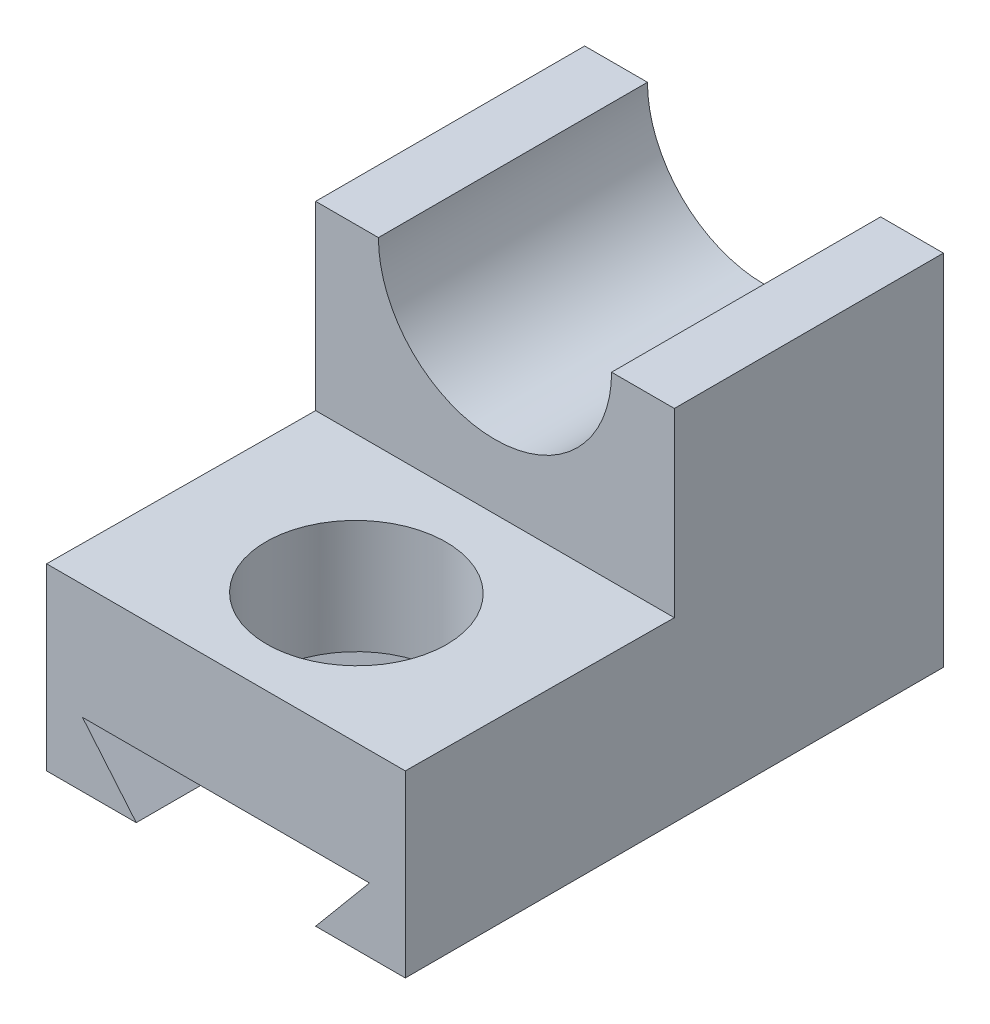
from build123d import *

# Parameters (mm, degrees)
EXTRUDE_1_DEPTH          = 508
CUT_EXTRUDE_1_DEPTH      = 1048.268828907
CUT_EXTRUDE_1_DEPTH_BACK = 1048.268828907
CUT_EXTRUDE_2_DEPTH      = 1048.268828907
CUT_EXTRUDE_2_DEPTH_BACK = 1048.268828907
CUT_EXTRUDE_3_DEPTH      = 1048.268828907
CUT_EXTRUDE_3_DEPTH_BACK = 1048.268828907
SKETCH_5_R               = 254


with BuildPart() as part:
    # 草图2 → 凸台-拉伸1 (new, symmetric)
    with BuildSketch(Plane(origin=(0, 0, 0), x_dir=(0, 0, -1), z_dir=(1, 0, 0))):
        Polygon((0, 508), (762, 508), (762, -508), (-762, -508), (-762, 0), (0, -5.276054191), align=None)
    extrude(amount=EXTRUDE_1_DEPTH, both=True)

    # 草图3 → 切除-拉伸1 (cut, two sides: drawn at the far end of the back side and taken through both)
    with BuildSketch(Plane.XY.offset(-CUT_EXTRUDE_1_DEPTH_BACK)):
        with BuildLine():
            Line((-330.2, 508), (330.2, 508))
            ThreePointArc((330.2, 508), (0, 177.8), (-330.2, 508))
        make_face()
    extrude(amount=CUT_EXTRUDE_1_DEPTH + CUT_EXTRUDE_1_DEPTH_BACK, mode=Mode.SUBTRACT)

    # 草图4 → 切除-拉伸2 (cut, two sides: drawn at the far end of the back side and taken through both)
    with BuildSketch(Plane.XY.offset(-CUT_EXTRUDE_2_DEPTH_BACK)):
        Polygon((-406.4, -325.779762396), (406.4, -325.779762396), (254, -508), (-254, -508), align=None)
    extrude(amount=CUT_EXTRUDE_2_DEPTH + CUT_EXTRUDE_2_DEPTH_BACK, mode=Mode.SUBTRACT)

    # 草图5 → 切除-拉伸3 (cut, two sides: drawn at the far end of the back side and taken through both)
    with BuildSketch(Plane(origin=(0, 0, 0), x_dir=(1, 0, 0), z_dir=(0, 1, 0)).offset(-CUT_EXTRUDE_3_DEPTH_BACK)):
        with Locations(Location((0, -392.691654486, 0), (0, 0, 270))):
            Circle(SKETCH_5_R)
    extrude(amount=CUT_EXTRUDE_3_DEPTH + CUT_EXTRUDE_3_DEPTH_BACK, mode=Mode.SUBTRACT)


solid = part.part
